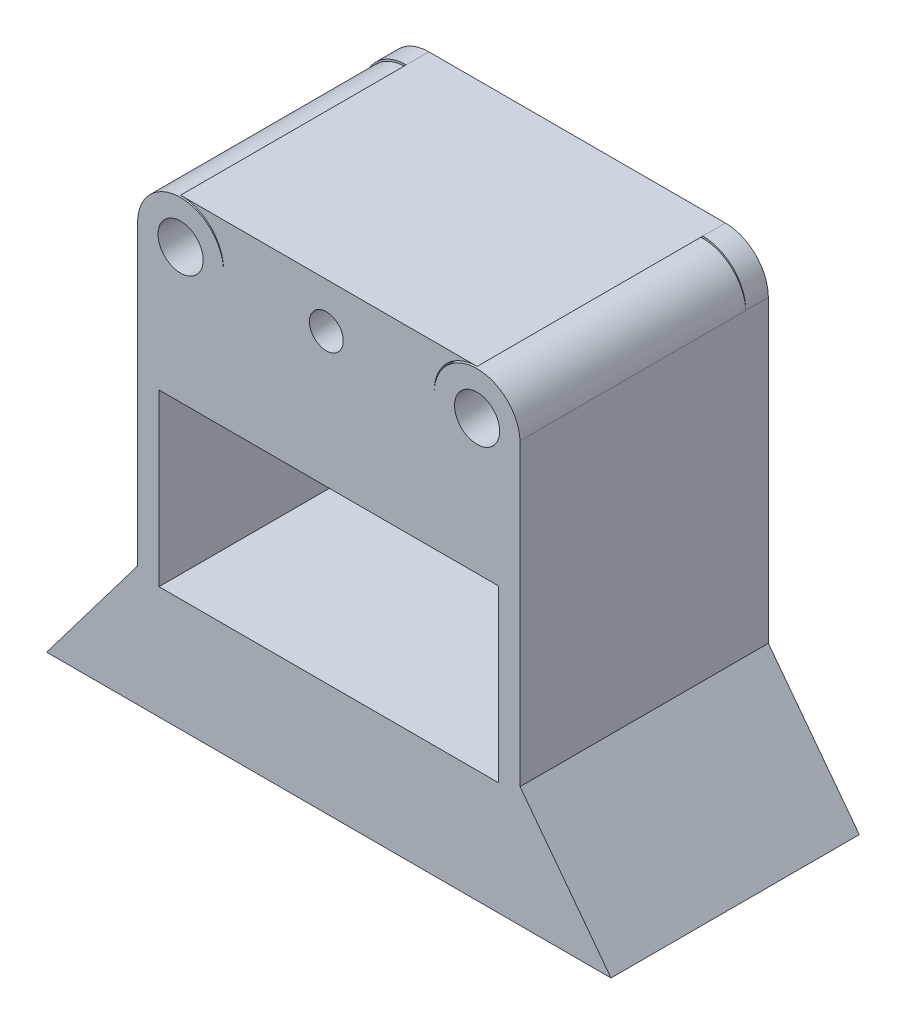
from build123d import *

# Parameters (mm, degrees)
SKETCH1_R           = 4.862500054
SKETCH1_W           = 76.454
SKETCH1_H           = 38.354
BOSS_EXTRUDE1_DEPTH = 50.8
BOSS_EXTRUDE2_DEPTH = 5.08
BOSS_EXTRUDE3_DEPTH = 55.88
SKETCH4_R           = 3.429
CUT_EXTRUDE1_DEPTH  = 50.8
SKETCH5_R           = 3.81
CUT_EXTRUDE2_DEPTH  = 50.8
SKETCH6_R           = 5.08
CUT_EXTRUDE3_DEPTH  = 50.8


with BuildPart() as part:
    # Sketch1 → Boss-Extrude1 (new body)
    with BuildSketch(Plane.XY):
        with BuildLine():
            Line((-43.029964919, -17.522331458), (-43.029964919, 19.177))
            Line((-43.029964919, 19.177), (-43.029964919, 49.89109769))
            ThreePointArc((-43.029964919, 49.89109769), (-33.369881409, 59.115507734), (-23.699543278, 49.901848605))
            Line((-23.699543278, 49.901848605), (0, 24.257))
            Line((0, 24.257), (23.699543278, 49.901848605))
            ThreePointArc((23.699543278, 49.901848605), (33.369881409, 59.115507734), (43.029964919, 49.89109769))
            Line((43.029964919, 49.89109769), (43.029964919, 19.177))
            Line((43.029964919, 19.177), (43.029964919, -17.522331458))
            Line((43.029964919, -17.522331458), (63.5, -44.577))
            Line((63.5, -44.577), (-63.5, -44.577))
            Line((-63.5, -44.577), (-43.029964919, -17.522331458))
        make_face()
        with Locations((-33.364499946, 49.439500054)):
            Circle(SKETCH1_R, mode=Mode.SUBTRACT)
        with Locations(Location((33.364499946, 49.439500054, 0), (0, 0, 180))):
            Circle(SKETCH1_R, mode=Mode.SUBTRACT)
        Rectangle(SKETCH1_W, SKETCH1_H, mode=Mode.SUBTRACT)
    extrude(amount=BOSS_EXTRUDE1_DEPTH)

    # Sketch2 → Boss-Extrude2 (add)
    with BuildSketch(Plane(origin=(0, 0, 0), x_dir=(-1, 0, 0), z_dir=(0, 0, -1))):
        with BuildLine():
            Line((-43.029964919, 49.89109769), (-43.029964919, -17.522331458))
            Line((-43.029964919, -17.522331458), (-63.5, -44.577))
            Line((-63.5, -44.577), (63.5, -44.577))
            Line((63.5, -44.577), (43.029964919, -17.522331458))
            Line((43.029964919, -17.522331458), (43.029964919, 49.89109769))
            ThreePointArc((43.029964919, 49.89109769), (33.370126568, 59.556310005), (23.699543278, 49.901848605))
            Line((23.699543278, 49.901848605), (0, 24.257))
            Line((0, 24.257), (-23.699543278, 49.901848605))
            ThreePointArc((-23.699543278, 49.901848605), (-33.370126568, 59.556310005), (-43.029964919, 49.89109769))
        make_face()
    extrude(amount=BOSS_EXTRUDE2_DEPTH)

    # Sketch3 → Boss-Extrude3 (add)
    with BuildSketch(Plane(origin=(0, 0, -5.08), x_dir=(-1, 0, 0), z_dir=(0, 0, -1))):
        with BuildLine():
            Line((-33.370126568, 59.556310005), (33.370126568, 59.556310005))
            ThreePointArc((33.370126568, 59.556310005), (26.537689117, 56.729560126), (23.699543278, 49.901848605))
            Line((23.699543278, 49.901848605), (0, 24.257))
            Line((0, 24.257), (-23.699543278, 49.901848605))
            ThreePointArc((-23.699543278, 49.901848605), (-26.537689117, 56.729560126), (-33.370126568, 59.556310005))
        make_face()
    extrude(amount=-BOSS_EXTRUDE3_DEPTH)

    # Sketch4 → Cut-Extrude1 (cut)
    with BuildSketch(Plane.XY.offset(50.8)):
        with Locations((-0.569554056, 49.439500054)):
            Circle(SKETCH4_R)
    extrude(amount=-CUT_EXTRUDE1_DEPTH, mode=Mode.SUBTRACT)

    # Sketch5 → Cut-Extrude2 (cut)
    with BuildSketch(Plane.XY.offset(50.8)):
        with Locations((-0.569554056, 49.439500054)):
            Circle(SKETCH5_R)
    extrude(amount=-CUT_EXTRUDE2_DEPTH, mode=Mode.SUBTRACT)

    # Sketch6 → Cut-Extrude3 (cut)
    with BuildSketch(Plane.XY.offset(50.8)):
        with Locations((-33.364499946, 49.439500054)):
            Circle(SKETCH6_R)
        with Locations((33.364499946, 49.439500054)):
            Circle(SKETCH6_R)
    extrude(amount=-CUT_EXTRUDE3_DEPTH, mode=Mode.SUBTRACT)


solid = part.part
